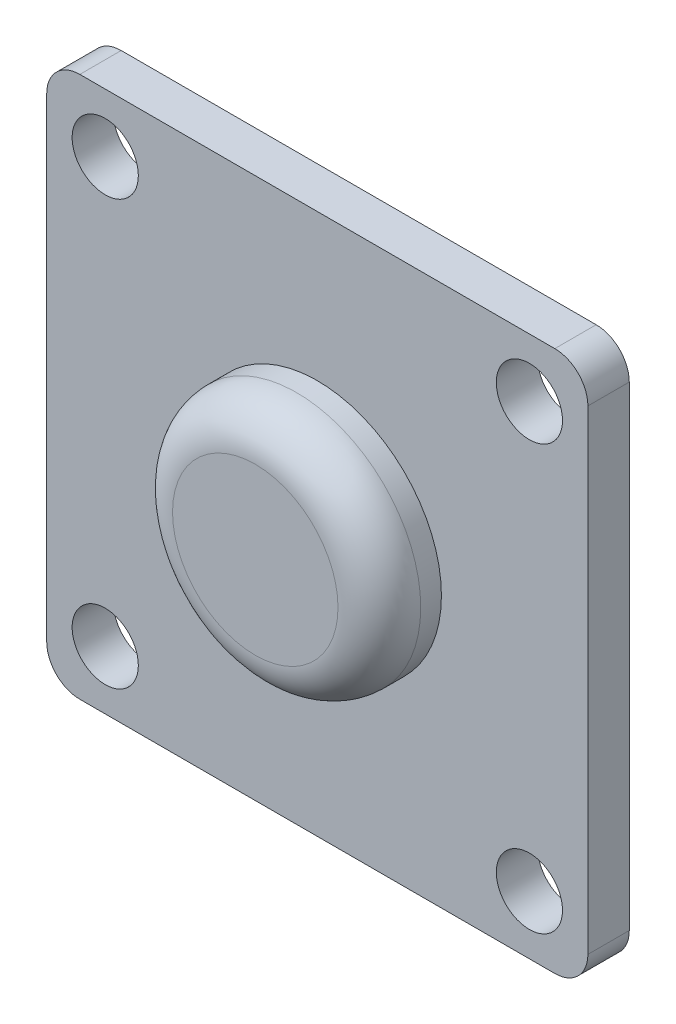
from build123d import *

# Parameters (mm, degrees)
SKETCH_1_W          = 26.162950904
SKETCH_1_H          = 26.162950904
SKETCH_1_R          = 1.6
EXTRUDE_1_DEPTH     = 2
SKETCH_2_R          = 6
EXTRUDE_2_DEPTH     = 3
SKETCH_3_R          = 3.1
CUT_EXTRUDE_1_DEPTH = 3
FILLET_2_R          = 2
FILLET_3_R          = 1.6


with BuildPart() as part:
    # 草图1 → 凸台-拉伸1 (new body)
    with BuildSketch(Plane.XY):
        Rectangle(SKETCH_1_W, SKETCH_1_H)
        with Locations((10.253048327, 10.253048327)):
            Circle(SKETCH_1_R, mode=Mode.SUBTRACT)
        with Locations((-10.253048327, 10.253048327)):
            Circle(SKETCH_1_R, mode=Mode.SUBTRACT)
        with Locations((-10.253048327, -10.253048327)):
            Circle(SKETCH_1_R, mode=Mode.SUBTRACT)
        with Locations((10.253048327, -10.253048327)):
            Circle(SKETCH_1_R, mode=Mode.SUBTRACT)
    extrude(amount=EXTRUDE_1_DEPTH)

    # 草图2 → 凸台-拉伸2 (add)
    with BuildSketch(Plane.XY.offset(2)):
        Circle(SKETCH_2_R)
    extrude(amount=EXTRUDE_2_DEPTH)

    # 草图3 → 切除-拉伸1 (cut)
    with BuildSketch(Plane(origin=(0, 0, 0), x_dir=(-1, 0, 0), z_dir=(0, 0, -1))):
        Circle(SKETCH_3_R)
    extrude(amount=-CUT_EXTRUDE_1_DEPTH, mode=Mode.SUBTRACT)

    # 圆角2
    fillet_2_edges = [part.edges().sort_by_distance(p)[0] for p in [
        (-6, 0, 5),
    ]]
    fillet(fillet_2_edges, radius=FILLET_2_R)

    # 圆角3
    fillet_3_edges = [part.edges().sort_by_distance(p)[0] for p in [
        (13.081475452, -13.081475452, 1),
        (-13.081475452, -13.081475452, 1),
        (-13.081475452, 13.081475452, 1),
        (13.081475452, 13.081475452, 1),
    ]]
    fillet(fillet_3_edges, radius=FILLET_3_R)


solid = part.part
